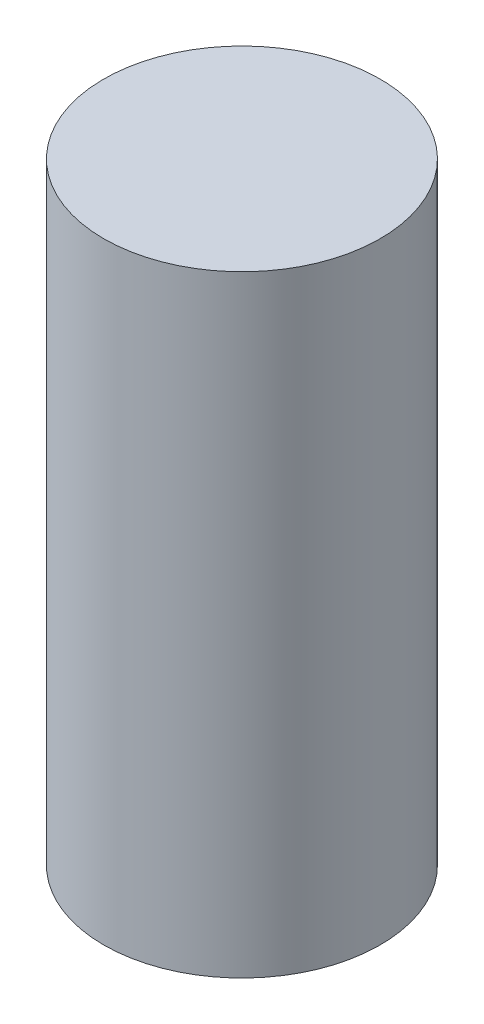
from build123d import *

# Parameters (mm, degrees)
SKETCH1_R           = 33
BOSS_EXTRUDE1_DEPTH = 146


with BuildPart() as part:
    # Sketch1 → Boss-Extrude1 (new body)
    with BuildSketch(Plane(origin=(0, 0, 0), x_dir=(1, 0, 0), z_dir=(0, 1, 0))):
        with Locations(Location((0, 0, 0), (0, 0, 270))):
            Circle(SKETCH1_R)
    extrude(amount=BOSS_EXTRUDE1_DEPTH)


solid = part.part
